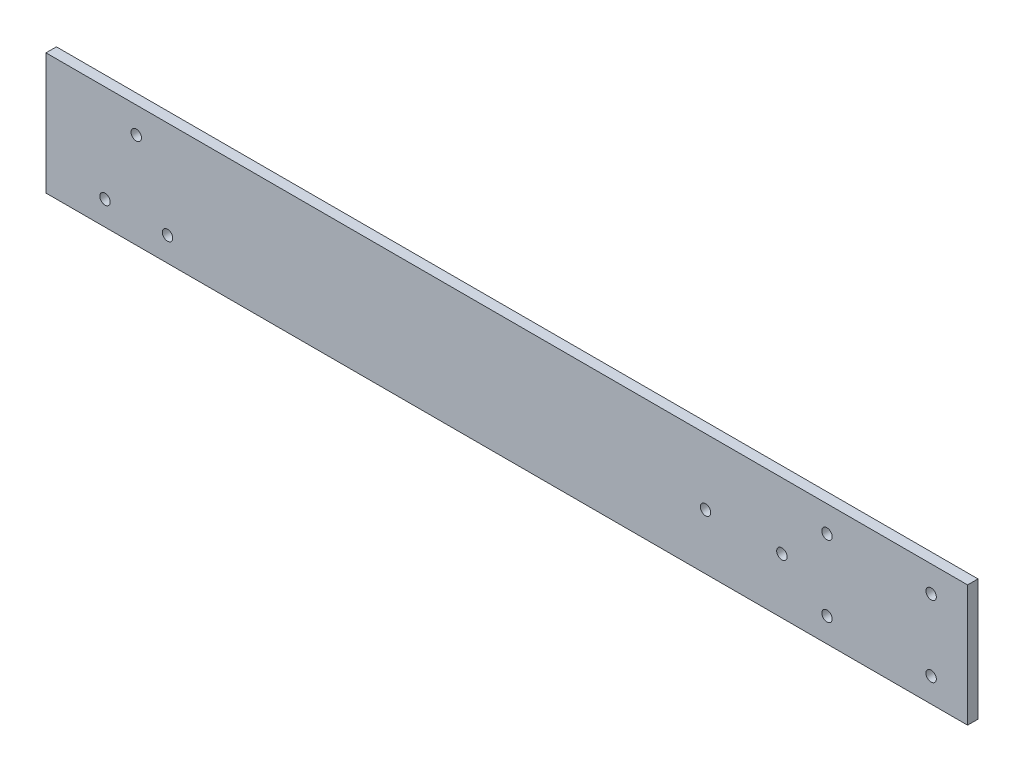
from build123d import *

# Parameters (mm, degrees)
CROQUIS1_W              = 265.5
CROQUIS1_H              = 35
CROQUIS1_R              = 1.5
SALIENTE_EXTRUIR1_DEPTH = 3


with BuildPart() as part:
    # Croquis1 → Saliente-Extruir1 (new body)
    with BuildSketch(Plane.XY):
        Rectangle(CROQUIS1_W, CROQUIS1_H)
        with Locations((79.25, -1.5)):
            Circle(CROQUIS1_R, mode=Mode.SUBTRACT)
        with Locations((-115.75, -10.5)):
            Circle(CROQUIS1_R, mode=Mode.SUBTRACT)
        with Locations((-97.75, -10.5)):
            Circle(CROQUIS1_R, mode=Mode.SUBTRACT)
        with Locations((-106.75, 10)):
            Circle(CROQUIS1_R, mode=Mode.SUBTRACT)
        with Locations((122.25, 10)):
            Circle(CROQUIS1_R, mode=Mode.SUBTRACT)
        with Locations((92.25, 10)):
            Circle(CROQUIS1_R, mode=Mode.SUBTRACT)
        with Locations((92.25, -10.5)):
            Circle(CROQUIS1_R, mode=Mode.SUBTRACT)
        with Locations((122.25, -10.5)):
            Circle(CROQUIS1_R, mode=Mode.SUBTRACT)
        with Locations((57.25, -1.5)):
            Circle(CROQUIS1_R, mode=Mode.SUBTRACT)
    extrude(amount=SALIENTE_EXTRUIR1_DEPTH)


solid = part.part
